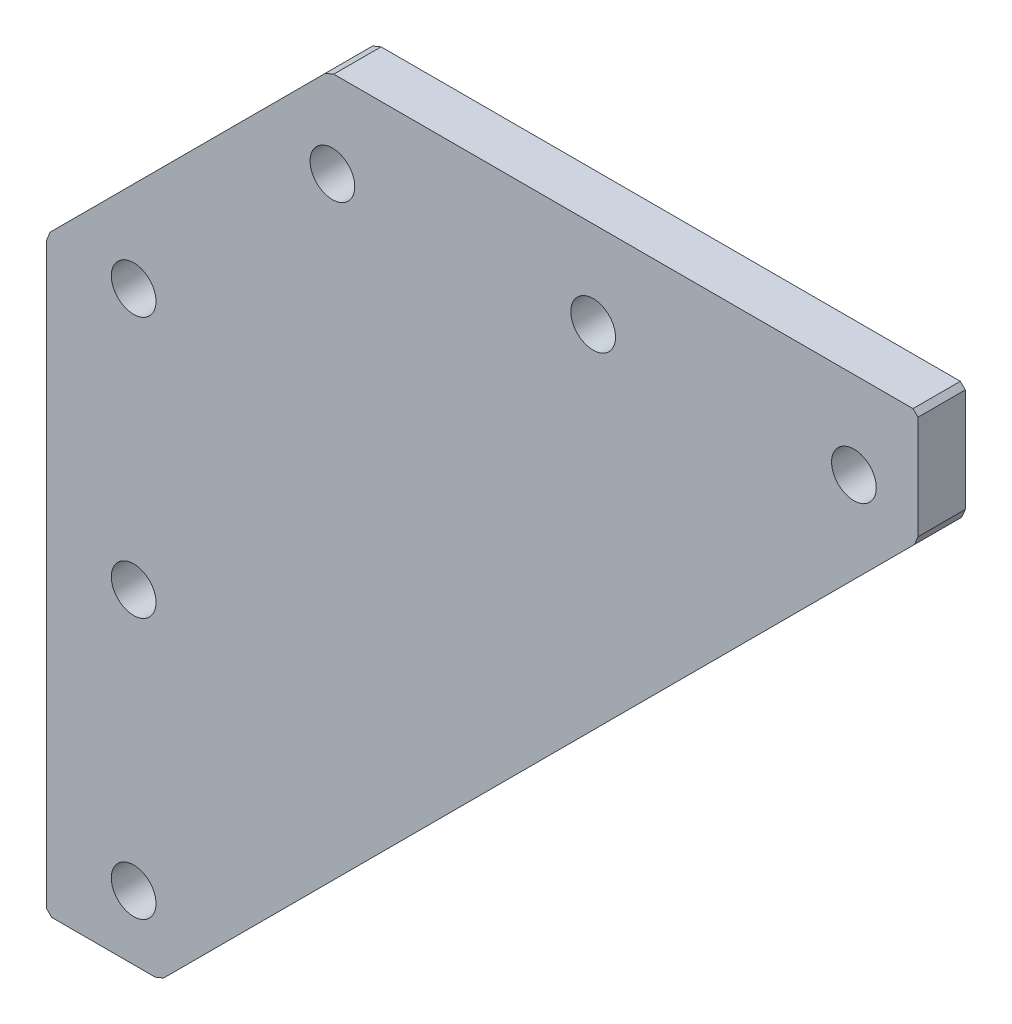
from build123d import *

# Parameters (mm, degrees)
BOSS_EXTRUDE1_DEPTH  = 4.7625
M8_CLEARANCE_HOLE1_D = 9
CHAMFER1_SIZE        = 1


with BuildPart() as part:
    # Sketch1 → Boss-Extrude1 (new, symmetric)
    with BuildSketch(Plane.XY):
        Polygon((-17.5, -157.849025767), (5.340097423, -157.849025767), (157.849025767, -5.340097423), (157.849025767, 17.5), (39.267766953, 17.5), (-17.5, -39.267766953), align=None)
    extrude(amount=BOSS_EXTRUDE1_DEPTH, both=True)

    # M8 Clearance Hole1 (through all)
    with Locations(Plane.XY.offset(4.7625)):
        with Locations((0, -92.478445072), (144.956890143, 0), (92.478445072, 0), (0, -40), (0, -144.956890143), (40, 0)):
            Hole(M8_CLEARANCE_HOLE1_D / 2)

    # Chamfer1
    chamfer1_edges = [part.edges().sort_by_distance(p)[0] for p in [
        (157.849025767, 17.5, 0),
        (157.849025767, -5.340097423, 0),
        (5.340097423, -157.849025767, 0),
        (-17.5, -157.849025767, 0),
        (-17.5, -39.267766953, 0),
        (39.267766953, 17.5, 0),
    ]]
    chamfer(chamfer1_edges, length=CHAMFER1_SIZE)


solid = part.part
